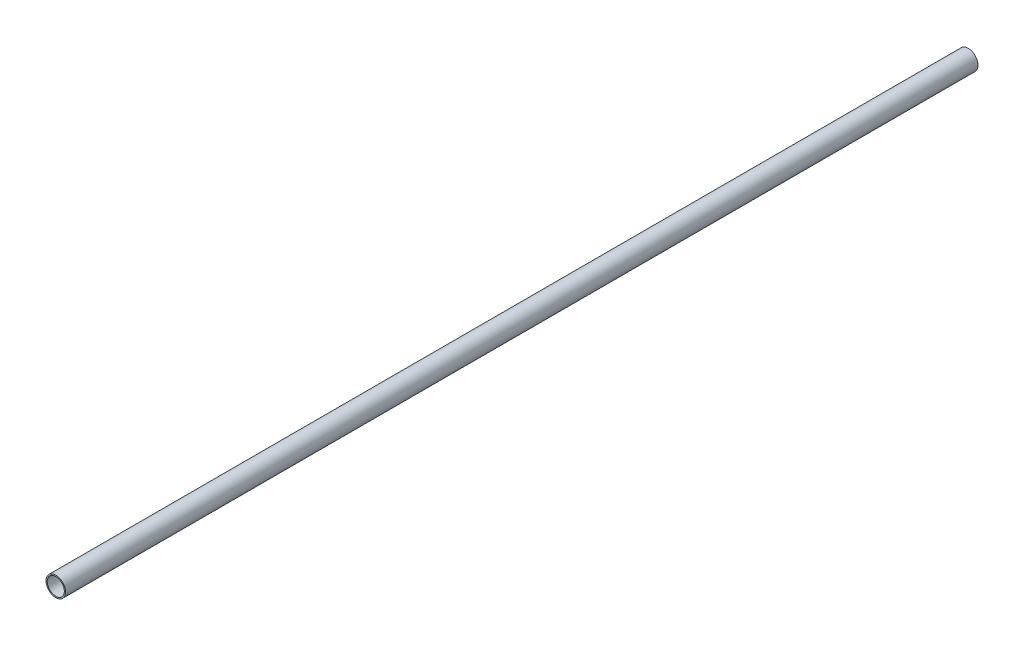
from build123d import *

# Parameters (mm, degrees)
SKETCH2_R           = 24.125
SKETCH2_R_2         = 21.075
BOSS_EXTRUDE1_DEPTH = 2250


with BuildPart() as part:
    # Sketch2 → Boss-Extrude1 (new body)
    with BuildSketch(Plane.XY):
        with Locations((2449.72011288, -5187.007415734)):
            Circle(SKETCH2_R)
        with Locations((2449.72011288, -5187.007415734)):
            Circle(SKETCH2_R_2, mode=Mode.SUBTRACT)
    extrude(amount=BOSS_EXTRUDE1_DEPTH)


solid = part.part
